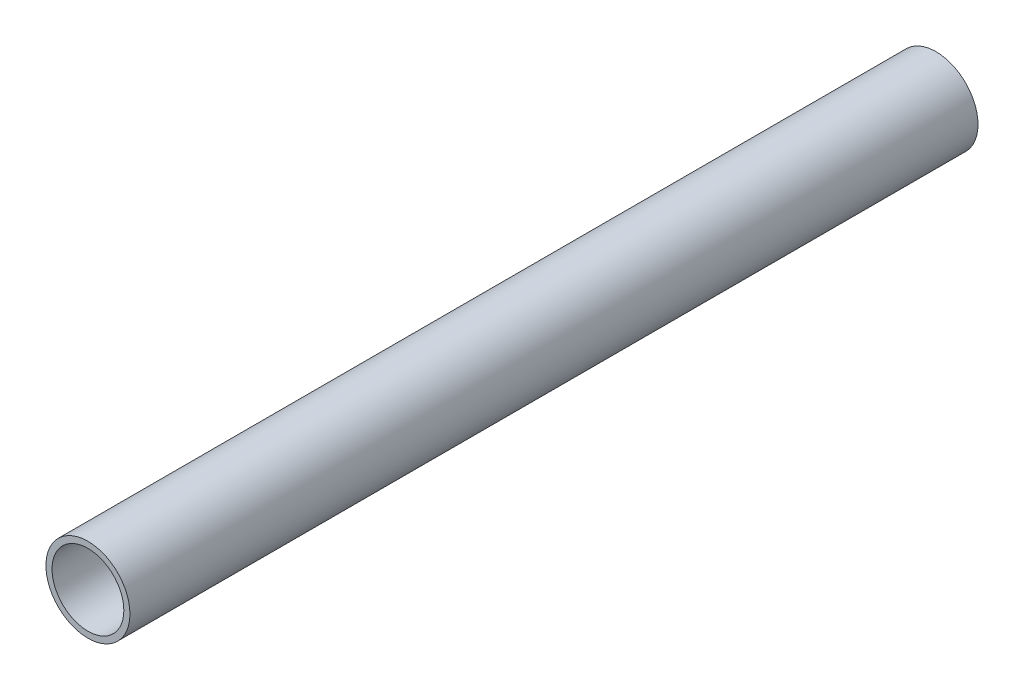
from build123d import *

# Parameters (mm, degrees)
CROQUIS1_R              = 29.72
CROQUIS1_R_2            = 25.4
SALIENTE_EXTRUIR1_DEPTH = 600


with BuildPart() as part:
    # Croquis1 → Saliente-Extruir1 (new body)
    with BuildSketch(Plane.XY):
        Circle(CROQUIS1_R)
        Circle(CROQUIS1_R_2, mode=Mode.SUBTRACT)
    extrude(amount=SALIENTE_EXTRUIR1_DEPTH)


solid = part.part
